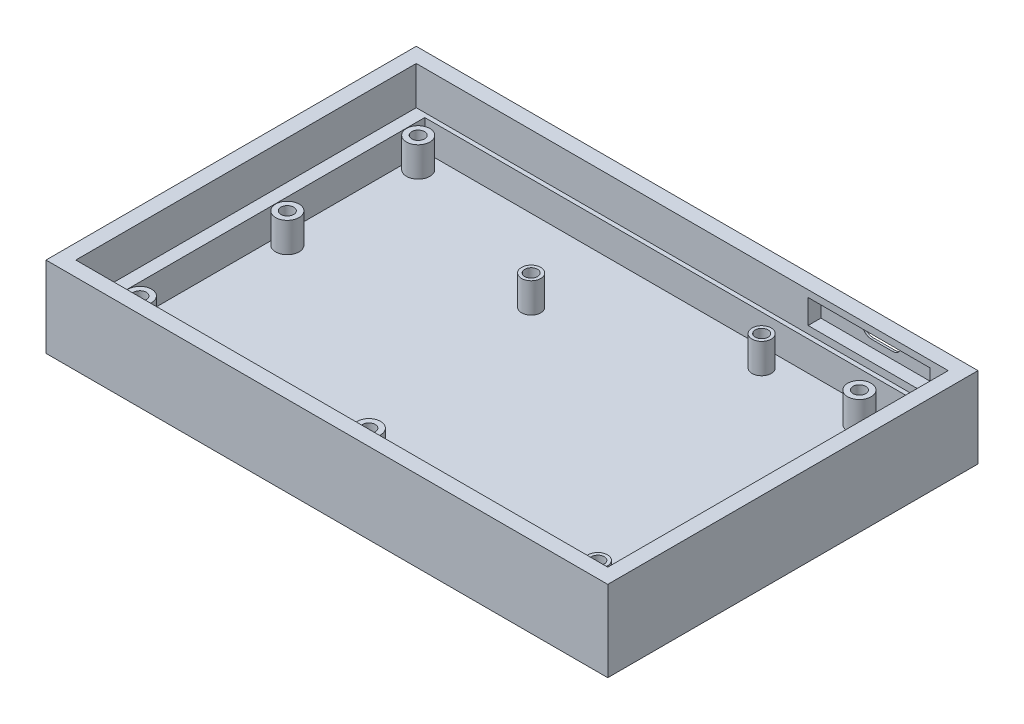
from build123d import *

# Parameters (mm, degrees)
SKETCH1_W           = 125
SKETCH1_H           = 80
BOSS_EXTRUDE1_DEPTH = 3
SKETCH1_3_W         = 132
SKETCH1_3_H         = 87
SKETCH1_3_W_2       = 125
SKETCH1_3_H_2       = 80
BOSS_EXTRUDE2_DEPTH = 19
SKETCH2_W           = 125
SKETCH2_H           = 80
SKETCH2_W_2         = 120
SKETCH2_H_2         = 76
BOSS_EXTRUDE3_DEPTH = 10
SKETCH3_W           = 28.6783421
SKETCH3_H           = 5.698707123
CUT_EXTRUDE1_DEPTH  = 3
CUT_EXTRUDE2_DEPTH  = 3
SKETCH5_R           = 2.75
SKETCH5_R_2         = 1.5
SKETCH5_R_3         = 2.259305414
BOSS_EXTRUDE4_DEPTH = 7


with BuildPart() as part:
    # Sketch1 → Boss-Extrude1 (new body)
    with BuildSketch(Plane(origin=(0, 0, 0), x_dir=(1, 0, 0), z_dir=(0, 1, 0))):
        Rectangle(SKETCH1_W, SKETCH1_H)
    extrude(amount=BOSS_EXTRUDE1_DEPTH)

    # Sketch1<3> → Boss-Extrude2 (add)
    with BuildSketch(Plane(origin=(0, 0, 0), x_dir=(1, 0, 0), z_dir=(0, 1, 0))):
        Rectangle(SKETCH1_3_W, SKETCH1_3_H)
        Rectangle(SKETCH1_3_W_2, SKETCH1_3_H_2, mode=Mode.SUBTRACT)
    extrude(amount=BOSS_EXTRUDE2_DEPTH)

    # Sketch2 → Boss-Extrude3 (add)
    with BuildSketch(Plane(origin=(0, 0, 0), x_dir=(1, 0, 0), z_dir=(0, 1, 0))):
        Rectangle(SKETCH2_W, SKETCH2_H)
        with Locations((0.5, 1)):
            Rectangle(SKETCH2_W_2, SKETCH2_H_2, mode=Mode.SUBTRACT)
    extrude(amount=BOSS_EXTRUDE3_DEPTH)

    # Sketch3 → Cut-Extrude1 (cut)
    with BuildSketch(Plane(origin=(0, 0, -40), x_dir=(-1, 0, 0), z_dir=(0, 0, -1))):
        with Locations((-43.918315426, 14.566401795)):
            Rectangle(SKETCH3_W, SKETCH3_H)
    extrude(amount=CUT_EXTRUDE1_DEPTH, mode=Mode.SUBTRACT)

    # Sketch4 → Cut-Extrude2 (cut)
    with BuildSketch(Plane(origin=(0, 0, -43.5), x_dir=(-1, 0, 0), z_dir=(0, 0, -1))):
        with BuildLine():
            Line((-46.454793207, 17.25655779), (-41.357520978, 17.25655779))
            ThreePointArc((-41.357520978, 17.25655779), (-39.417949113, 15.316985924), (-41.357520978, 13.377414059))
            Line((-41.357520978, 13.377414059), (-46.454793207, 13.377414059))
            ThreePointArc((-46.454793207, 13.377414059), (-48.394365073, 15.316985924), (-46.454793207, 17.25655779))
        make_face()
    extrude(amount=-CUT_EXTRUDE2_DEPTH, mode=Mode.SUBTRACT)

    # Sketch5 → Boss-Extrude4 (add)
    # profile 1 of 8: a face of its own
    with BuildSketch(Plane(origin=(0, 3, 0), x_dir=(1, 0, 0), z_dir=(0, 1, 0))):
        with Locations((-56.666408857, -30.772899219)):
            Circle(SKETCH5_R)
        with Locations((-56.666408857, -30.772899219)):
            Circle(SKETCH5_R_2, mode=Mode.SUBTRACT)
    # profile 2 of 8: a face of its own
    with BuildSketch(Plane(origin=(0, 3, 0), x_dir=(1, 0, 0), z_dir=(0, 1, 0))):
        with Locations((-56.666408857, 34.623451832)):
            Circle(SKETCH5_R)
        with Locations((-56.666408857, 34.623451832)):
            Circle(SKETCH5_R_2, mode=Mode.SUBTRACT)
    # profile 3 of 8: a face of its own
    with BuildSketch(Plane(origin=(0, 3, 0), x_dir=(1, 0, 0), z_dir=(0, 1, 0))):
        with Locations((-56.666408857, 3.874879483)):
            Circle(SKETCH5_R)
        with Locations((-56.666408857, 3.874879483)):
            Circle(SKETCH5_R_2, mode=Mode.SUBTRACT)
    # profile 4 of 8: a face of its own
    with BuildSketch(Plane(origin=(0, 3, 0), x_dir=(1, 0, 0), z_dir=(0, 1, 0))):
        with Locations((-15.376408857, 19.879433801)):
            Circle(SKETCH5_R_3)
        with Locations((-15.376408857, 19.879433801)):
            Circle(SKETCH5_R_2, mode=Mode.SUBTRACT)
    # profile 5 of 8: a face of its own
    with BuildSketch(Plane(origin=(0, 3, 0), x_dir=(1, 0, 0), z_dir=(0, 1, 0))):
        with Locations((24.041591143, 34.623451832)):
            Circle(SKETCH5_R_3)
        with Locations((24.041591143, 34.623451832)):
            Circle(SKETCH5_R_2, mode=Mode.SUBTRACT)
    # profile 6 of 8: a face of its own
    with BuildSketch(Plane(origin=(0, 3, 0), x_dir=(1, 0, 0), z_dir=(0, 1, 0))):
        with Locations((50.940615446, -30.772899219)):
            Circle(SKETCH5_R_3)
        with Locations((50.940615446, -30.772899219)):
            Circle(SKETCH5_R_2, mode=Mode.SUBTRACT)
    # profile 7 of 8: a face of its own
    with BuildSketch(Plane(origin=(0, 3, 0), x_dir=(1, 0, 0), z_dir=(0, 1, 0))):
        with Locations((-2.862896706, -30.772899219)):
            Circle(SKETCH5_R)
        with Locations((-2.862896706, -30.772899219)):
            Circle(SKETCH5_R_2, mode=Mode.SUBTRACT)
    # profile 8 of 8: a face of its own
    with BuildSketch(Plane(origin=(0, 3, 0), x_dir=(1, 0, 0), z_dir=(0, 1, 0))):
        with Locations((47.016763874, 34.623451832)):
            Circle(SKETCH5_R)
        with Locations((47.016763874, 34.623451832)):
            Circle(SKETCH5_R_2, mode=Mode.SUBTRACT)
    extrude(amount=BOSS_EXTRUDE4_DEPTH)


solid = part.part
